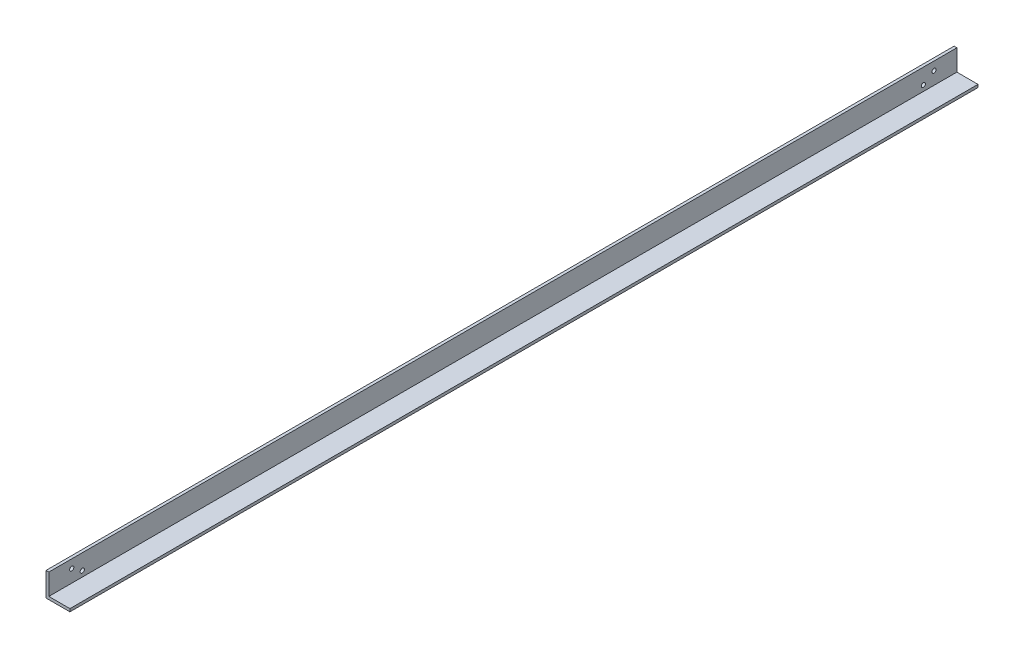
from build123d import *

# Parameters (mm, degrees)
EXTRUDE_1_DEPTH     = 645
SKETCH_2_R          = 1.5
CUT_EXTRUDE_2_DEPTH = 646.305354077
SKETCH_3_W          = 2
SKETCH_3_H          = 2
EXTRUDE_2_DEPTH     = 645


with BuildPart() as part:
    # Эскиз1 → Бобышка-Вытянуть1 (new body)
    with BuildSketch(Plane.XY):
        Polygon((0, 0), (0, 13), (-2, 13), (-2, -2), (13, -2), (13, 0), align=None)
    extrude(amount=-EXTRUDE_1_DEPTH)

    # Эскиз2 → Вырез-Вытянуть2 (cut, through all)
    with BuildSketch(Plane.ZY.offset(2)):
        with Locations(Location((-23.79, 4, 0), (0, 0, 270))):
            Circle(SKETCH_2_R)
        with Locations(Location((-16.29, 9, 0), (0, 0, 270))):
            Circle(SKETCH_2_R)
        with Locations(Location((-628.71, 9, 0), (0, 0, 270))):
            Circle(SKETCH_2_R)
        with Locations(Location((-621.21, 4, 0), (0, 0, 270))):
            Circle(SKETCH_2_R)
    extrude(amount=-CUT_EXTRUDE_2_DEPTH, mode=Mode.SUBTRACT)

    # Эскиз3 → Бобышка-Вытянуть2 (add)
    with BuildSketch(Plane(origin=(0, 0, -645), x_dir=(-1, 0, 0), z_dir=(0, 0, -1))):
        with Locations((-14, -1)):
            Rectangle(SKETCH_3_W, SKETCH_3_H)
        with Locations((1, 14)):
            Rectangle(SKETCH_3_W, SKETCH_3_H)
    extrude(amount=-EXTRUDE_2_DEPTH)


solid = part.part
